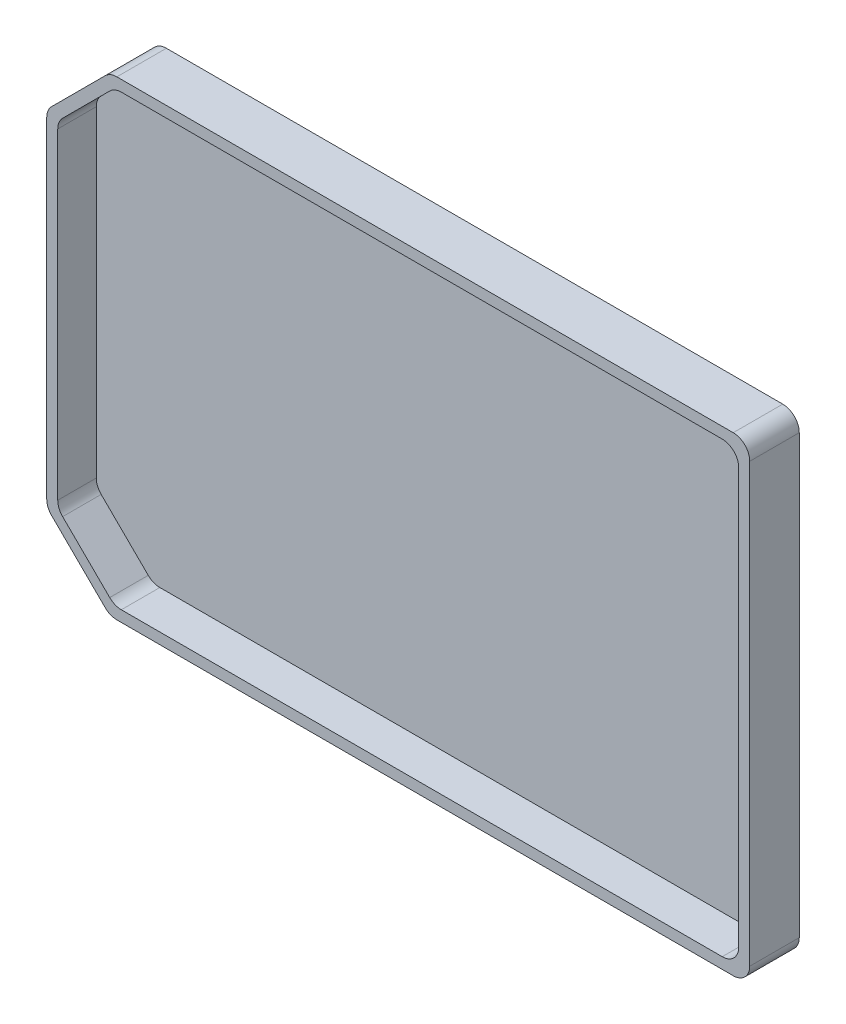
from build123d import *

# Parameters (mm, degrees)
PLATE_LID_W         = 127.76
PLATE_LID_H         = 85.47
PLATE_LID_9MM_DEPTH = 9
STYLE_DEPTH         = 79.091185472
LID_THICKNESS_T     = -2
FILLET2_R           = 3


with BuildPart() as part:
    # Plate Lid → Plate Lid (9mm) (new body)
    with BuildSketch(Plane.XY):
        with Locations((0.417682409, -0.659023613)):
            Rectangle(PLATE_LID_W, PLATE_LID_H)
    extrude(amount=PLATE_LID_9MM_DEPTH)

    # Sketch2 → Style (cut, through all)
    with BuildSketch(Plane.XY):
        Polygon((-63.462317591, -43.394023613), (-51.962317591, -43.394023613), (-63.462317591, -32.024023613), align=None)
        Polygon((-63.462317591, 30.575976387), (-51.962317591, 42.075976387), (-63.462317591, 42.075976387), align=None)
    extrude(amount=STYLE_DEPTH, mode=Mode.SUBTRACT)

    # Lid Thickness
    lid_thickness_openings = [part.faces().sort_by_distance(p)[0] for p in [
        (1.149623535, -0.661456466, 9),
    ]]
    offset(amount=LID_THICKNESS_T, openings=lid_thickness_openings, kind=Kind.INTERSECTION)

    # Fillet2
    fillet2_edges = [part.edges().sort_by_distance(p)[0] for p in [
        (-63.462317591, -32.024023613, 4.5),
        (-51.962317591, -43.394023613, 4.5),
        (-63.462317591, 30.575976387, 4.5),
        (-51.962317591, 42.075976387, 4.5),
        (-61.462317591, 29.747549263, 5.5),
        (62.297682409, 40.075976387, 5.5),
        (-51.140542157, -41.394023613, 5.5),
        (62.297682409, -41.394023613, 5.5),
        (-61.462317591, -31.188929118, 5.5),
        (-51.133890467, 40.075976387, 5.5),
        (64.297682409, -43.394023613, 4.5),
        (64.297682409, 42.075976387, 4.5),
    ]]
    fillet(fillet2_edges, radius=FILLET2_R)


solid = part.part
